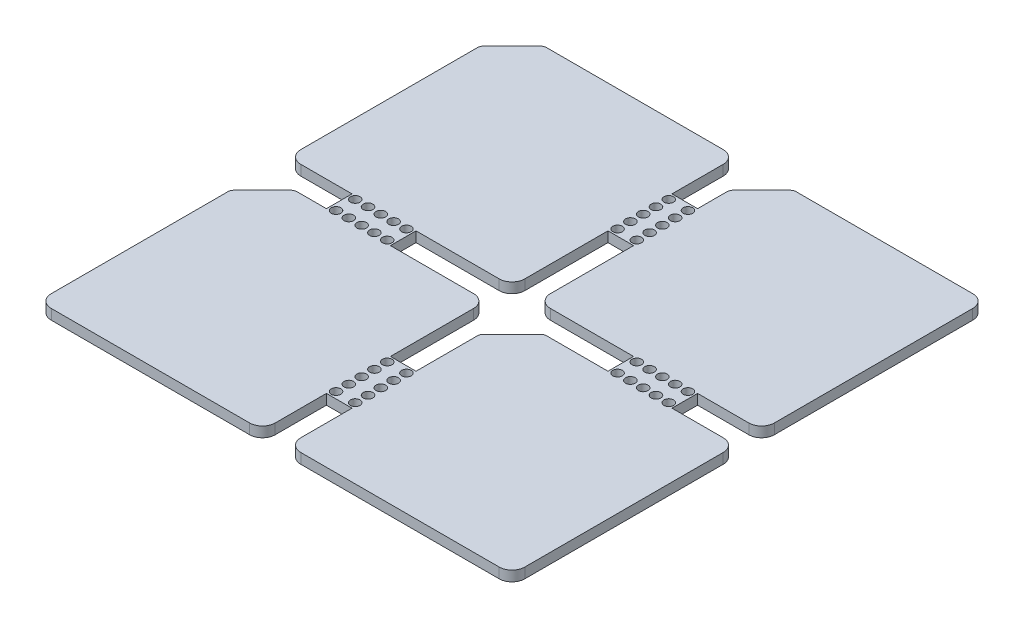
from build123d import *

# Parameters (mm, degrees)
SKETCH_1_W          = 35
SKETCH_1_H          = 35
EXTRUDE_1_DEPTH     = 1.6
EXTRUDE_1_2_DEPTH   = 1.6
EXTRUDE_1_3_DEPTH   = 1.6
EXTRUDE_1_4_DEPTH   = 1.6
SKETCH_2_W          = 10
SKETCH_2_H          = 4
SKETCH_2_W_2        = 4
SKETCH_2_H_2        = 10
EXTRUDE_2_DEPTH     = 1.6
CHAMFER_1_SIZE      = 5
FILLET_1_R          = 1
FILLET_2_R          = 2
SKETCH_3_R          = 0.75
CUT_EXTRUDE_1_DEPTH = 105.664033937
SKETCH_4_R          = 0.75
CUT_EXTRUDE_2_DEPTH = 105.664033937


with BuildPart() as part:
    # 草图1 → 凸台-拉伸1 (new body)
    with BuildSketch(Plane(origin=(0, 0, 0), x_dir=(1, 0, 0), z_dir=(0, 1, 0))):
        with Locations((56.5, -17.5)):
            Rectangle(SKETCH_1_W, SKETCH_1_H)
    extrude(amount=EXTRUDE_1_DEPTH)



with BuildPart() as body_2:
    # 草图1 → Extrude 1 2 (new body)
    with BuildSketch(Plane(origin=(0, 0, 0), x_dir=(1, 0, 0), z_dir=(0, 1, 0))):
        with Locations((17.5, -17.5)):
            Rectangle(SKETCH_1_W, SKETCH_1_H)
    extrude(amount=EXTRUDE_1_2_DEPTH)


with BuildPart() as body_3:
    # 草图1 → Extrude 1 3 (new body)
    with BuildSketch(Plane(origin=(0, 0, 0), x_dir=(1, 0, 0), z_dir=(0, 1, 0))):
        with Locations((17.5, -56.5)):
            Rectangle(SKETCH_1_W, SKETCH_1_H)
    extrude(amount=EXTRUDE_1_3_DEPTH)


with BuildPart() as body_4:
    # 草图1 → Extrude 1 4 (new body)
    with BuildSketch(Plane(origin=(0, 0, 0), x_dir=(1, 0, 0), z_dir=(0, 1, 0))):
        with Locations((56.5, -56.5)):
            Rectangle(SKETCH_1_W, SKETCH_1_H)
    extrude(amount=EXTRUDE_1_4_DEPTH)


with BuildPart() as part_1:
    add(part.part)

    add(body_2.part)  # 凸台-拉伸2 merges body 2

    add(body_3.part)  # 凸台-拉伸2 merges body 3

    add(body_4.part)  # 凸台-拉伸2 merges body 4
    # 草图2 → 凸台-拉伸2 (add)
    with BuildSketch(Plane(origin=(0, 1.6, 0), x_dir=(1, 0, 0), z_dir=(0, 1, 0))):
        with Locations((15, -37)):
            Rectangle(SKETCH_2_W, SKETCH_2_H)
        with Locations((37, -15)):
            Rectangle(SKETCH_2_W_2, SKETCH_2_H_2)
        with Locations((59, -37)):
            Rectangle(SKETCH_2_W, SKETCH_2_H)
        with Locations((37, -59)):
            Rectangle(SKETCH_2_W_2, SKETCH_2_H_2)
    extrude(amount=-EXTRUDE_2_DEPTH)

    # 倒角1
    chamfer_1_edges = [part_1.edges().sort_by_distance(p)[0] for p in [
        (0, 0.8, 39),
        (39, 0.8, 0),
        (39, 0.8, 39),
        (0, 0.8, 0),
    ]]
    chamfer(chamfer_1_edges, length=CHAMFER_1_SIZE)

    # 圆角1
    fillet_1_edges = [part_1.edges().sort_by_distance(p)[0] for p in [
        (44, 0.8, 39),
        (0, 0.8, 44),
        (5, 0.8, 39),
        (39, 0.8, 5),
        (44, 0.8, 0),
        (0, 0.8, 5),
        (5, 0.8, 0),
        (39, 0.8, 44),
    ]]
    fillet(fillet_1_edges, radius=FILLET_1_R)

    # 圆角2
    fillet_2_edges = [part_1.edges().sort_by_distance(p)[0] for p in [
        (35, 0.8, 39),
        (0, 0.8, 74),
        (35, 0.8, 74),
        (39, 0.8, 35),
        (74, 0.8, 35),
        (74, 0.8, 0),
        (39, 0.8, 74),
        (74, 0.8, 74),
        (74, 0.8, 39),
        (35, 0.8, 0),
        (35, 0.8, 35),
        (0, 0.8, 35),
    ]]
    fillet(fillet_2_edges, radius=FILLET_2_R)

    # 草图3 → 切除-拉伸1 (cut, through all)
    with BuildSketch(Plane(origin=(0, 1.6, 0), x_dir=(1, 0, 0), z_dir=(0, 1, 0))):
        with Locations(Location((11, -35.5, 0), (0, 0, 270))):
            Circle(SKETCH_3_R)
        with Locations(Location((63, -35.5, 0), (0, 0, 270))):
            Circle(SKETCH_3_R)
        with Locations(Location((63, -38.5, 0), (0, 0, 90))):
            Circle(SKETCH_3_R)
        with Locations(Location((11, -38.5, 0), (0, 0, 90))):
            Circle(SKETCH_3_R)
        with Locations(Location((13, -38.5, 0), (0, 0, 90))):
            Circle(SKETCH_3_R)
        with Locations(Location((13, -35.5, 0), (0, 0, 270))):
            Circle(SKETCH_3_R)
        with Locations(Location((15, -38.5, 0), (0, 0, 90))):
            Circle(SKETCH_3_R)
        with Locations(Location((15, -35.5, 0), (0, 0, 270))):
            Circle(SKETCH_3_R)
        with Locations(Location((17, -38.5, 0), (0, 0, 90))):
            Circle(SKETCH_3_R)
        with Locations(Location((17, -35.5, 0), (0, 0, 270))):
            Circle(SKETCH_3_R)
        with Locations(Location((19, -38.5, 0), (0, 0, 90))):
            Circle(SKETCH_3_R)
        with Locations(Location((19, -35.5, 0), (0, 0, 270))):
            Circle(SKETCH_3_R)
        with Locations(Location((61, -35.5, 0), (0, 0, 270))):
            Circle(SKETCH_3_R)
        with Locations(Location((61, -38.5, 0), (0, 0, 90))):
            Circle(SKETCH_3_R)
        with Locations(Location((59, -35.5, 0), (0, 0, 270))):
            Circle(SKETCH_3_R)
        with Locations(Location((59, -38.5, 0), (0, 0, 90))):
            Circle(SKETCH_3_R)
        with Locations(Location((57, -35.5, 0), (0, 0, 270))):
            Circle(SKETCH_3_R)
        with Locations(Location((57, -38.5, 0), (0, 0, 90))):
            Circle(SKETCH_3_R)
        with Locations(Location((55, -35.5, 0), (0, 0, 270))):
            Circle(SKETCH_3_R)
        with Locations(Location((55, -38.5, 0), (0, 0, 90))):
            Circle(SKETCH_3_R)
    extrude(amount=-CUT_EXTRUDE_1_DEPTH, mode=Mode.SUBTRACT)

    # 草图4 → 切除-拉伸2 (cut, through all)
    with BuildSketch(Plane(origin=(0, 1.6, 0), x_dir=(1, 0, 0), z_dir=(0, 1, 0))):
        with Locations(Location((35.5, -11, 0), (0, 0, 270))):
            Circle(SKETCH_4_R)
        with Locations(Location((38.5, -11, 0), (0, 0, 270))):
            Circle(SKETCH_4_R)
        with Locations(Location((35.5, -13, 0), (0, 0, 270))):
            Circle(SKETCH_4_R)
        with Locations(Location((38.5, -13, 0), (0, 0, 270))):
            Circle(SKETCH_4_R)
        with Locations(Location((35.5, -15, 0), (0, 0, 270))):
            Circle(SKETCH_4_R)
        with Locations(Location((38.5, -15, 0), (0, 0, 270))):
            Circle(SKETCH_4_R)
        with Locations(Location((35.5, -17, 0), (0, 0, 270))):
            Circle(SKETCH_4_R)
        with Locations(Location((38.5, -17, 0), (0, 0, 270))):
            Circle(SKETCH_4_R)
        with Locations(Location((35.5, -19, 0), (0, 0, 270))):
            Circle(SKETCH_4_R)
        with Locations(Location((38.5, -19, 0), (0, 0, 270))):
            Circle(SKETCH_4_R)
        with Locations(Location((35.5, -63, 0), (0, 0, 270))):
            Circle(SKETCH_4_R)
        with Locations(Location((38.5, -63, 0), (0, 0, 270))):
            Circle(SKETCH_4_R)
        with Locations(Location((35.5, -61, 0), (0, 0, 270))):
            Circle(SKETCH_4_R)
        with Locations(Location((38.5, -61, 0), (0, 0, 270))):
            Circle(SKETCH_4_R)
        with Locations(Location((35.5, -59, 0), (0, 0, 270))):
            Circle(SKETCH_4_R)
        with Locations(Location((38.5, -59, 0), (0, 0, 270))):
            Circle(SKETCH_4_R)
        with Locations(Location((35.5, -57, 0), (0, 0, 270))):
            Circle(SKETCH_4_R)
        with Locations(Location((38.5, -57, 0), (0, 0, 270))):
            Circle(SKETCH_4_R)
        with Locations(Location((35.5, -55, 0), (0, 0, 270))):
            Circle(SKETCH_4_R)
        with Locations(Location((38.5, -55, 0), (0, 0, 270))):
            Circle(SKETCH_4_R)
    extrude(amount=-CUT_EXTRUDE_2_DEPTH, mode=Mode.SUBTRACT)


solid = part_1.part
